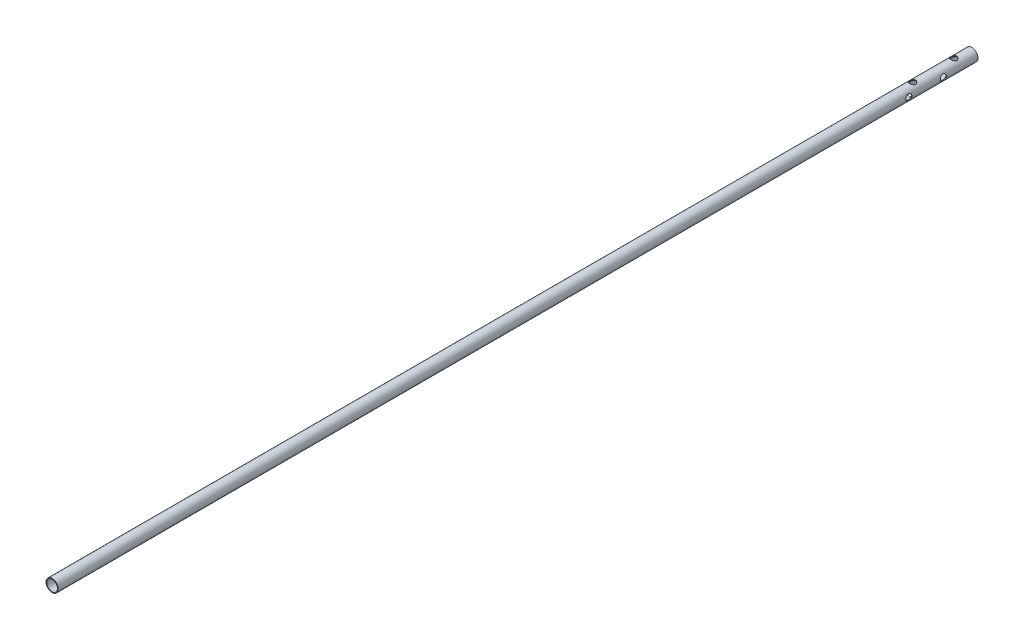
from build123d import *

# Parameters (mm, degrees)
SKETCH_1_R               = 8
SKETCH_1_R_2             = 7
EXTRUDE_1_DEPTH          = 600
CUT_EXTRUDE_1_DEPTH      = 601.106657187
CUT_EXTRUDE_1_DEPTH_BACK = 601.106657187
SKETCH_2_R               = 4
CUT_EXTRUDE_2_DEPTH      = 601.10665729
CUT_EXTRUDE_2_DEPTH_BACK = 601.10665729
SKETCH_3_R               = 4


with BuildPart() as part:
    # Эскиз1 → Бобышка-Вытянуть1 (new, symmetric)
    with BuildSketch(Plane.XY):
        Circle(SKETCH_1_R)
        Circle(SKETCH_1_R_2, mode=Mode.SUBTRACT)
    extrude(amount=EXTRUDE_1_DEPTH, both=True)

    # Эскиз2 → Вырез-Вытянуть1 (cut, two sides: drawn at the far end of the back side and taken through both)
    with BuildSketch(Plane(origin=(0, 0, 0), x_dir=(0, 0, -1), z_dir=(1, 0, 0)).offset(-CUT_EXTRUDE_1_DEPTH_BACK)):
        with Locations((510, 0)):
            Circle(SKETCH_2_R)
        with Locations((555, 0)):
            Circle(SKETCH_2_R)
    extrude(amount=CUT_EXTRUDE_1_DEPTH + CUT_EXTRUDE_1_DEPTH_BACK, mode=Mode.SUBTRACT)

    # Эскиз3 → Вырез-Вытянуть2 (cut, two sides: drawn at the far end of the back side and taken through both)
    with BuildSketch(Plane(origin=(0, 0, 0), x_dir=(1, 0, 0), z_dir=(0, 1, 0)).offset(-CUT_EXTRUDE_2_DEPTH_BACK)):
        with Locations(Location((0, 576.5, 0), (0, 0, 270))):
            Circle(SKETCH_3_R)
        with Locations(Location((0, 522.5, 0), (0, 0, 270))):
            Circle(SKETCH_3_R)
    extrude(amount=CUT_EXTRUDE_2_DEPTH + CUT_EXTRUDE_2_DEPTH_BACK, mode=Mode.SUBTRACT)


solid = part.part
